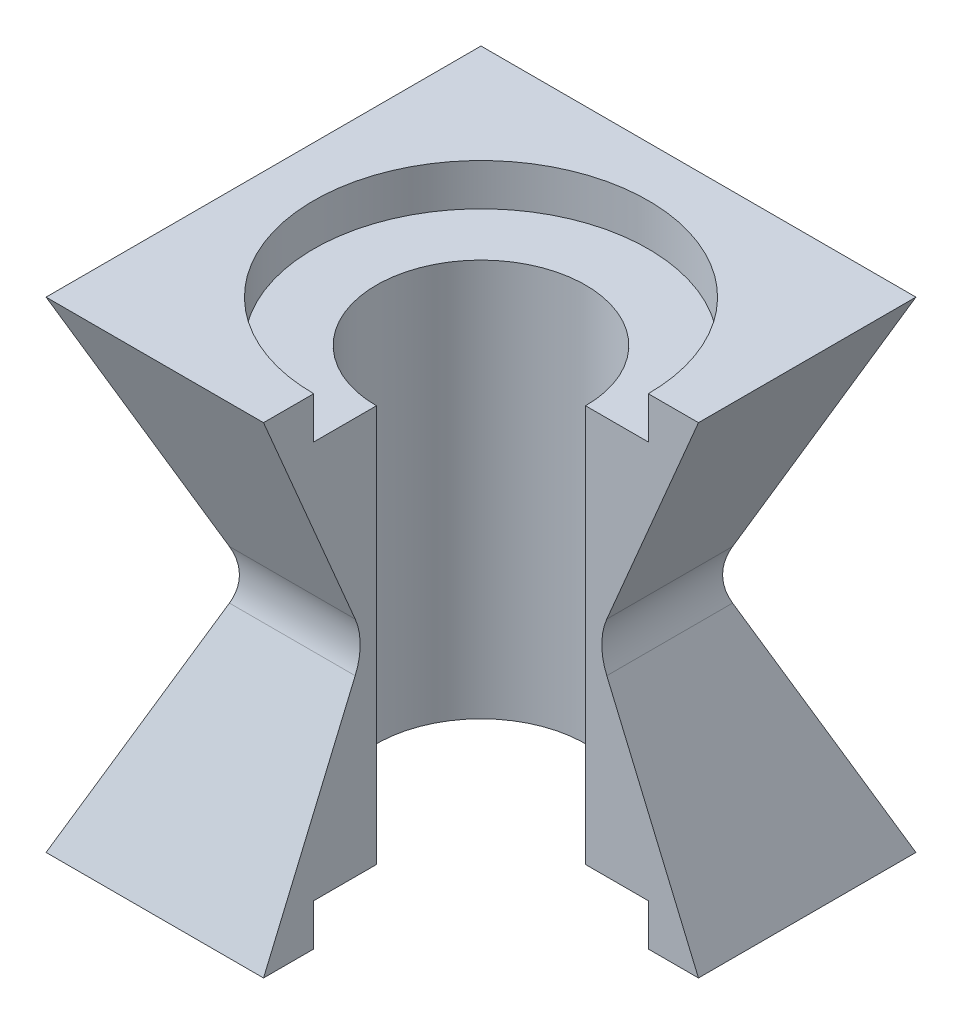
from build123d import *

# Parameters (mm, degrees)
SKETCH2_W               = 104
SKETCH2_H               = 115
BOSS_EXTRUDE1_DEPTH     = 104
CUT_EXTRUDE1_DEPTH      = 187.70029459
CUT_EXTRUDE2_DEPTH      = 187.70029459
SKETCH5_R               = 25
CUT_EXTRUDE3_DEPTH      = 187.70029459
SKETCH7_R               = 40
CUT_EXTRUDE4_DEPTH      = 10
FILLET1_R               = 15
SKETCH8_W               = 52
SKETCH8_H               = 52
CUT_EXTRUDE5_DEPTH      = 187.70029459
CUT_EXTRUDE6_DEPTH      = 187.70029459
CUT_EXTRUDE6_DEPTH_BACK = 10


with BuildPart() as part:
    # Sketch2 → Boss-Extrude1 (new body)
    with BuildSketch(Plane.XY):
        with Locations((52, 57.5)):
            Rectangle(SKETCH2_W, SKETCH2_H)
    extrude(amount=BOSS_EXTRUDE1_DEPTH)

    # Sketch3 → Cut-Extrude1 (cut, through all)
    with BuildSketch(Plane.XY.offset(104)):
        Polygon((0, 115), (24.407301932, 57.5), (0, 0), align=None)
        Polygon((104, 115), (79.592698068, 57.5), (104, 0), align=None)
    extrude(amount=-CUT_EXTRUDE1_DEPTH, mode=Mode.SUBTRACT)

    # Sketch4 → Cut-Extrude2 (cut, through all)
    with BuildSketch(Plane(origin=(0, 0, 0), x_dir=(0, 0, -1), z_dir=(1, 0, 0))):
        Polygon((-104, 115), (-79.592698068, 57.5), (-104, 0), align=None)
        Polygon((0, 115), (-24.407301932, 57.5), (0, 0), align=None)
    extrude(amount=CUT_EXTRUDE2_DEPTH, mode=Mode.SUBTRACT)

    # Sketch5 → Cut-Extrude3 (cut, through all)
    with BuildSketch(Plane(origin=(0, 115, 0), x_dir=(1, 0, 0), z_dir=(0, 1, 0))):
        with Locations(Location((52, -52, 0), (0, 0, 270))):
            Circle(SKETCH5_R)
    extrude(amount=-CUT_EXTRUDE3_DEPTH, mode=Mode.SUBTRACT)

    # Sketch7 → Cut-Extrude4 (cut)
    with BuildSketch(Plane(origin=(0, 115, 0), x_dir=(1, 0, 0), z_dir=(0, 1, 0))):
        with Locations(Location((52, -52, 0), (0, 0, 270))):
            Circle(SKETCH7_R)
    extrude(amount=-CUT_EXTRUDE4_DEPTH, mode=Mode.SUBTRACT)

    # Fillet1
    fillet1_edges = [part.edges().sort_by_distance(p)[0] for p in [
        (24.407301932, 57.5, 52),
        (79.592698068, 57.5, 52),
        (52, 57.5, 79.592698068),
        (52, 57.5, 24.407301932),
    ]]
    fillet(fillet1_edges, radius=FILLET1_R)

    # Sketch8 → Cut-Extrude5 (cut, through all)
    with BuildSketch(Plane(origin=(0, 115, 0), x_dir=(1, 0, 0), z_dir=(0, 1, 0))):
        with Locations((78, -78)):
            Rectangle(SKETCH8_W, SKETCH8_H)
    extrude(amount=-CUT_EXTRUDE5_DEPTH, mode=Mode.SUBTRACT)

    # Sketch9 → Cut-Extrude6 (cut, two sides: drawn at the far end of the back side and taken through both)
    with BuildSketch(Plane.XZ.offset(-CUT_EXTRUDE6_DEPTH_BACK)):
        with BuildLine():
            Line((52, 77), (52, 92))
            ThreePointArc((52, 92), (23.715728753, 23.715728753), (92, 52))
            Line((92, 52), (77, 52))
            ThreePointArc((77, 52), (34.32233047, 34.32233047), (52, 77))
        make_face()
    extrude(amount=CUT_EXTRUDE6_DEPTH + CUT_EXTRUDE6_DEPTH_BACK, mode=Mode.SUBTRACT)


solid = part.part
